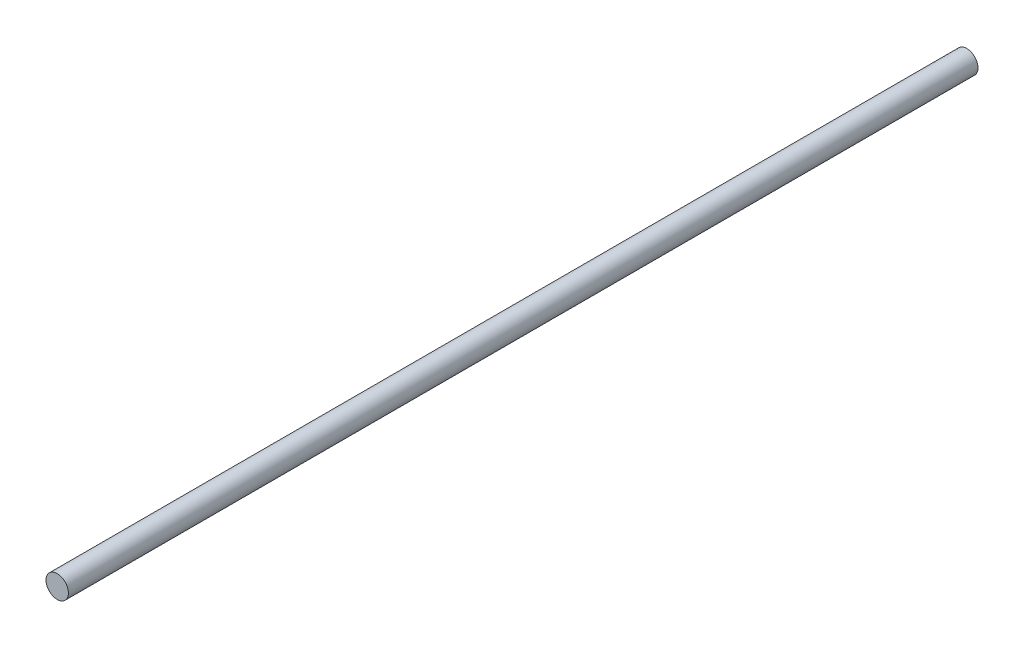
from build123d import *

# Parameters (mm, degrees)
SKETCH1_R           = 12.7
BOSS_EXTRUDE1_DEPTH = 1030


with BuildPart() as part:
    # Sketch1 → Boss-Extrude1 (new body)
    with BuildSketch(Plane.XY):
        Circle(SKETCH1_R)
    extrude(amount=BOSS_EXTRUDE1_DEPTH)


solid = part.part
